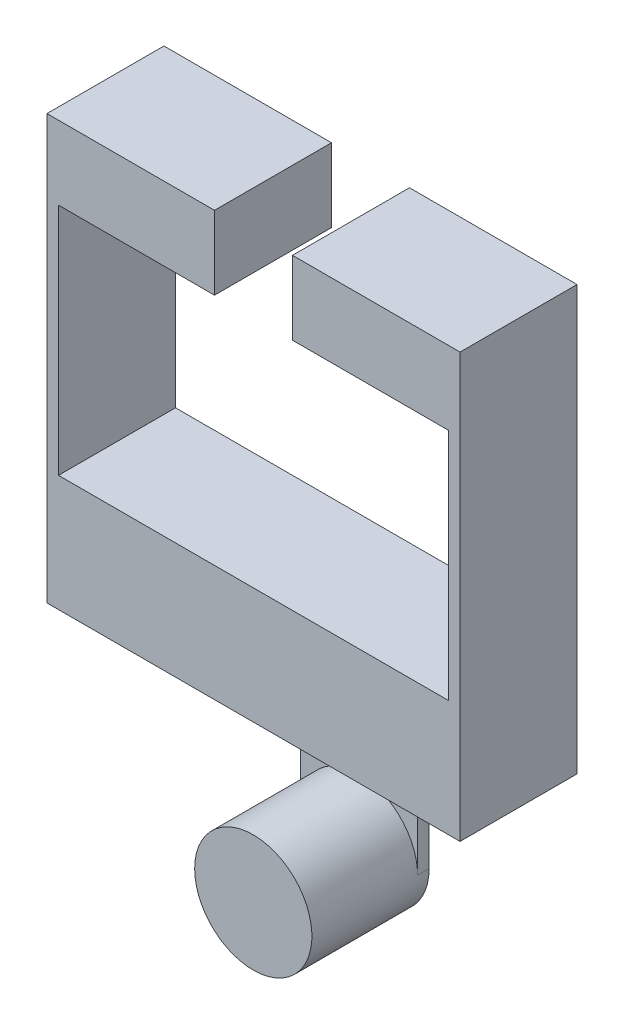
from build123d import *

# Parameters (mm, degrees)
BOSS_EXTRUDE1_DEPTH = 19.05
SKETCH2_W           = 19.08812797
SKETCH2_H           = 1.877723278
BOSS_EXTRUDE3_DEPTH = 25.4
SKETCH3_R           = 9.544063985
BOSS_EXTRUDE4_DEPTH = 19.08812797


with BuildPart() as part:
    # Sketch1 → Boss-Extrude1 (new body)
    with BuildSketch(Plane.XY):
        Polygon((-33.631481481, 34.502858519), (-33.631481481, -34.502858519), (33.631481481, -34.502858519), (33.631481481, 34.502858519), (6.35, 34.502858519), (6.35, 22.529183691), (31.75, 22.529183691), (31.75, -15.570816309), (-31.75, -15.570816309), (-31.75, 22.529183691), (-6.35, 22.529183691), (-6.35, 34.502858519), align=None)
    extrude(amount=BOSS_EXTRUDE1_DEPTH)

    # Sketch2 → Boss-Extrude3 (add)
    with BuildSketch(Plane.XZ.offset(34.502858519)):
        with Locations((0, 0.938861639)):
            Rectangle(SKETCH2_W, SKETCH2_H)
    extrude(amount=BOSS_EXTRUDE3_DEPTH)

    # Sketch3 → Boss-Extrude4 (add)
    with BuildSketch(Plane(origin=(0, 0, 0), x_dir=(-1, 0, 0), z_dir=(0, 0, -1))):
        with Locations((0, -59.902858519)):
            Circle(SKETCH3_R)
    extrude(amount=-BOSS_EXTRUDE4_DEPTH)


solid = part.part
